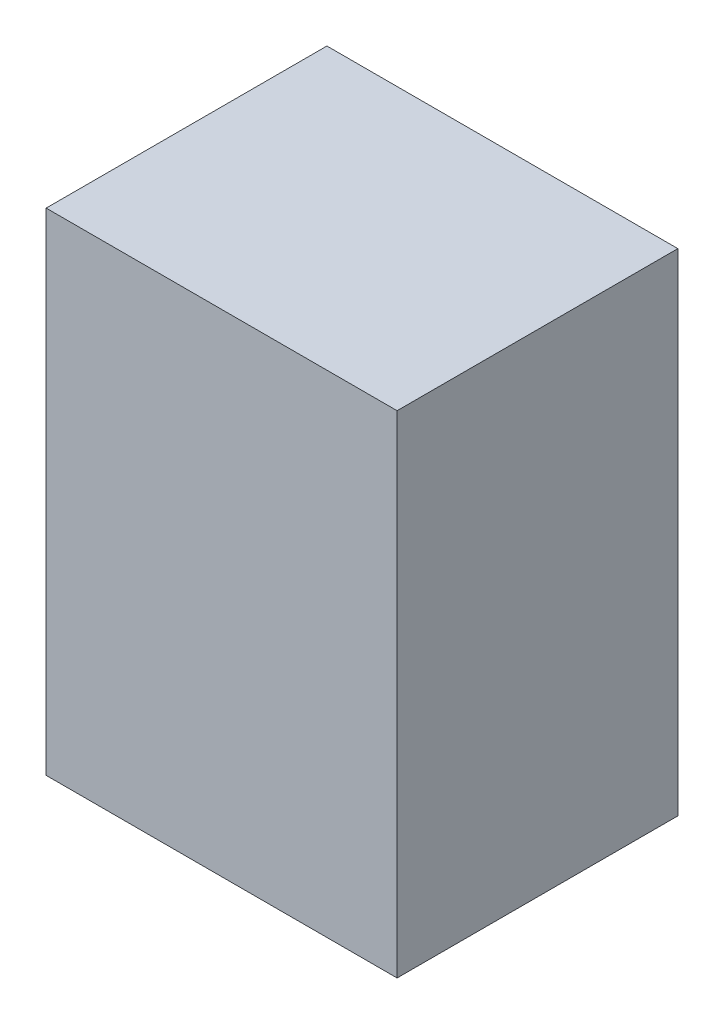
from build123d import *

# Parameters (mm, degrees)
SKETCH1_W           = 254
SKETCH1_H           = 203.2
BOSS_EXTRUDE1_DEPTH = 355.6


with BuildPart() as part:
    # Sketch1 → Boss-Extrude1 (new body)
    with BuildSketch(Plane(origin=(0, 0, 0), x_dir=(1, 0, 0), z_dir=(0, 1, 0))):
        with Locations((127, 101.6)):
            Rectangle(SKETCH1_W, SKETCH1_H)
    extrude(amount=BOSS_EXTRUDE1_DEPTH)


solid = part.part
